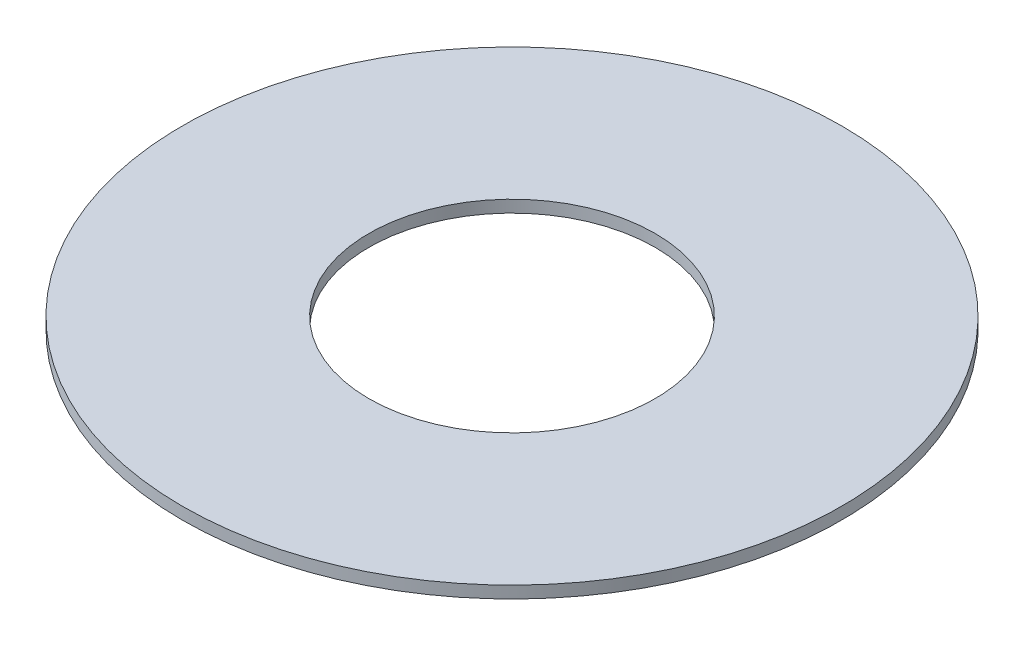
from build123d import *

# Parameters (mm, degrees)
SKETCH1_R           = 22.225
SKETCH1_R_2         = 9.652
BOSS_EXTRUDE1_DEPTH = 0.8128


with BuildPart() as part:
    # Sketch1 → Boss-Extrude1 (new body)
    with BuildSketch(Plane(origin=(0, 0, 0), x_dir=(1, 0, 0), z_dir=(0, 1, 0))):
        with Locations(Location((0, 0, 0), (0, 0, 270))):
            Circle(SKETCH1_R)
        with Locations(Location((0, 0, 0), (0, 0, 270))):
            Circle(SKETCH1_R_2, mode=Mode.SUBTRACT)
    extrude(amount=BOSS_EXTRUDE1_DEPTH)


solid = part.part
